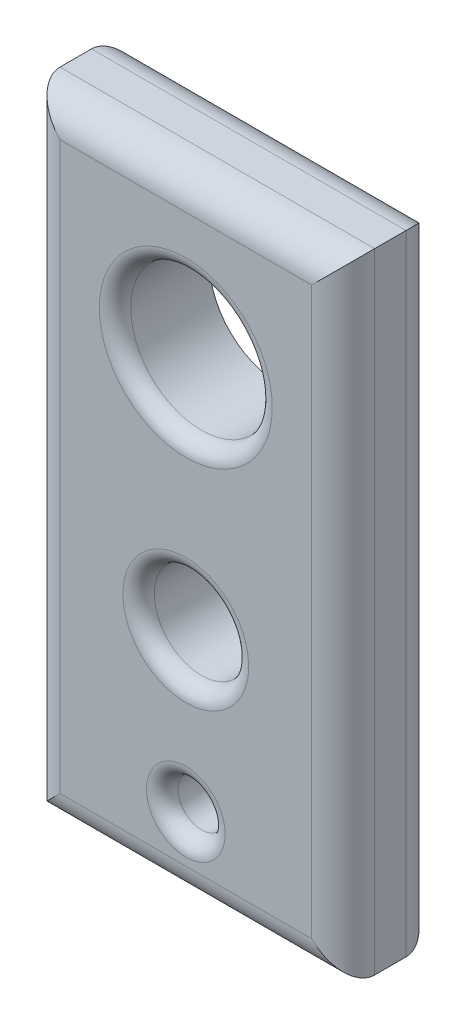
from build123d import *

# Parameters (mm, degrees)
SKETCH1_W           = 2540
SKETCH1_H           = 5080
BOSS_EXTRUDE1_DEPTH = 762
FILLET1_R           = 254
SKETCH2_R           = 190.5
SKETCH2_R_2         = 381
SKETCH2_R_3         = 571.5
CUT_EXTRUDE1_DEPTH  = 5731.501199721
FILLET2_R           = 127


with BuildPart() as part:
    # Sketch1 → Boss-Extrude1 (new body)
    with BuildSketch(Plane.XY):
        with Locations((1270, 2540)):
            Rectangle(SKETCH1_W, SKETCH1_H)
    extrude(amount=BOSS_EXTRUDE1_DEPTH)

    # Fillet1
    fillet1_edges = [part.edges().sort_by_distance(p)[0] for p in [
        (2540, 2540, 762),
        (1270, 5080, 762),
        (0, 2540, 762),
        (1270, 5080, 0),
        (2540, 2540, 0),
        (1270, 0, 0),
        (0, 2540, 0),
        (1270, 0, 762),
    ]]
    fillet(fillet1_edges, radius=FILLET1_R)

    # Sketch2 → Cut-Extrude1 (cut, through all)
    with BuildSketch(Plane.XY.offset(762)):
        with Locations((1270, 635)):
            Circle(SKETCH2_R)
        with Locations((1270, 1905)):
            Circle(SKETCH2_R_2)
        with Locations((1270, 3810)):
            Circle(SKETCH2_R_3)
    extrude(amount=-CUT_EXTRUDE1_DEPTH, mode=Mode.SUBTRACT)

    # Fillet2
    fillet2_edges = [part.edges().sort_by_distance(p)[0] for p in [
        (1079.5, 635, 762),
        (889, 1905, 762),
        (698.5, 3810, 762),
    ]]
    fillet(fillet2_edges, radius=FILLET2_R)


solid = part.part
